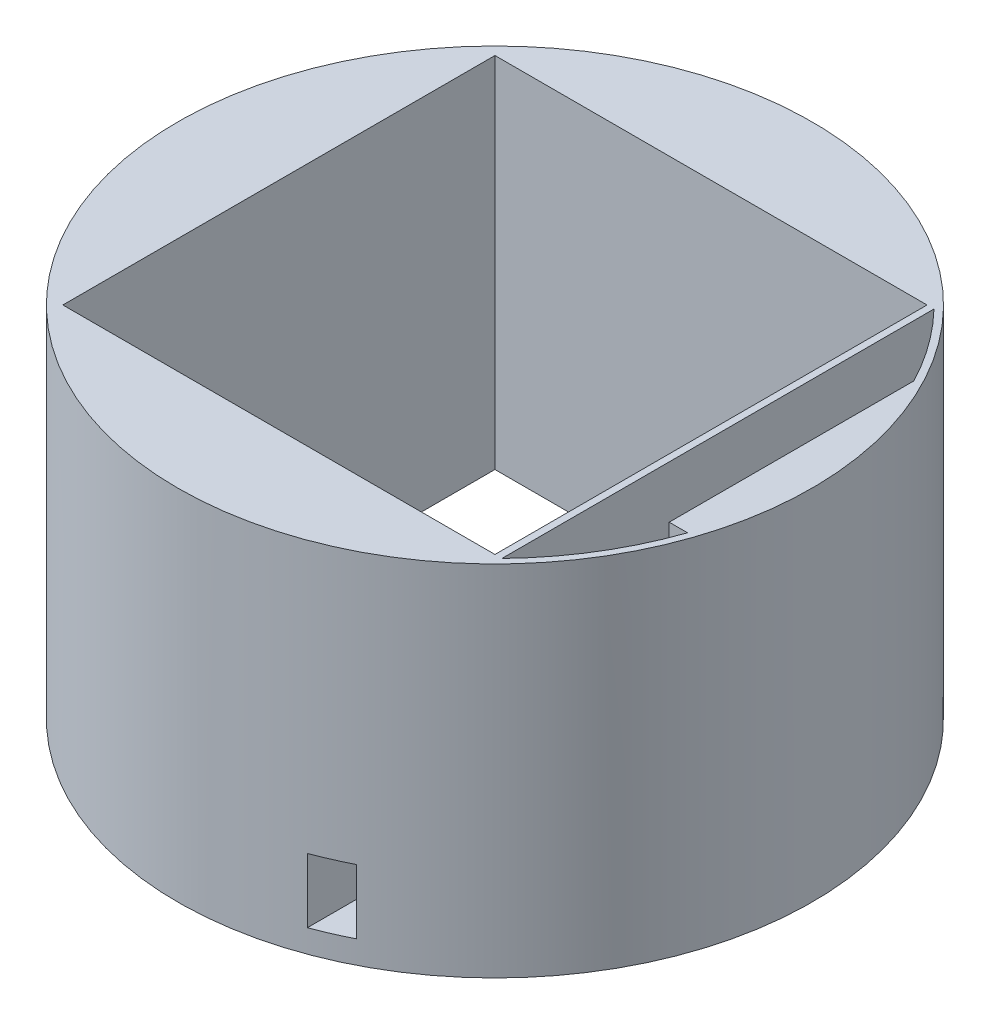
from build123d import *

# Parameters (mm, degrees)
BOSS_EXTRUDE1_DEPTH = 2.5
BOSS_EXTRUDE2_DEPTH = 4.5
SKETCH3_W           = 0.753987371
SKETCH3_H           = 12.516496397
BOSS_EXTRUDE3_DEPTH = 2.5
BOSS_EXTRUDE4_DEPTH = 29.5


with BuildPart() as part:
    # Sketch1 → Boss-Extrude1 (new body)
    with BuildSketch(Plane(origin=(0, 0, 0), x_dir=(1, 0, 0), z_dir=(0, 1, 0))):
        with BuildLine():
            Line((23.5, -23.5), (-23.5, -23.5))
            Line((-23.5, -23.5), (-25.258661881, -23.5))
            ThreePointArc((-25.258661881, -23.5), (12.625889377, -32.106649116), (34.5, 0))
            ThreePointArc((34.5, 0), (-5.56461177, 34.04827596), (-32.704933093, -10.983503603))
            Line((-32.704933093, -10.983503603), (-23.5, -10.983503603))
            Line((-23.5, -10.983503603), (-23.5, 23.5))
            Line((-23.5, 23.5), (23.5, 23.5))
            Line((23.5, 23.5), (23.5, -10.983503603))
            Line((23.5, -10.983503603), (31.93538088, -10.983503603))
            ThreePointArc((31.93538088, -10.983503603), (28.783275467, -17.66434139), (24.253987371, -23.5))
            Line((24.253987371, -23.5), (23.5, -23.5))
        make_face()
    extrude(amount=BOSS_EXTRUDE1_DEPTH)

    # Sketch2 → Boss-Extrude2 (add)
    with BuildSketch(Plane(origin=(0, 2.5, 0), x_dir=(1, 0, 0), z_dir=(0, 1, 0))):
        with BuildLine():
            Line((23.5, 23.5), (23.5, -10.983503603))
            Line((23.5, -10.983503603), (31.93538088, -10.983503603))
            ThreePointArc((31.93538088, -10.983503603), (28.783275467, -17.66434139), (24.253987371, -23.5))
            Line((24.253987371, -23.5), (15.688360219, -23.5))
            Line((15.688360219, -23.5), (15.688360219, -30.726622881))
            ThreePointArc((15.688360219, -30.726622881), (13.032214999, 31.943878478), (-32.704933093, -10.983503603))
            Line((-32.704933093, -10.983503603), (-23.5, -10.983503603))
            Line((-23.5, -10.983503603), (-23.5, 23.5))
            Line((-23.5, 23.5), (23.5, 23.5))
        make_face()
        with BuildLine():
            Line((11.957302625, -23.5), (-25.258661881, -23.5))
            ThreePointArc((-25.258661881, -23.5), (-7.991464927, -33.561681846), (11.957302625, -32.361596282))
            Line((11.957302625, -32.361596282), (11.957302625, -23.5))
        make_face()
    extrude(amount=BOSS_EXTRUDE2_DEPTH)

    # Sketch3 → Boss-Extrude3 (add)
    with BuildSketch(Plane(origin=(0, 7, 0), x_dir=(1, 0, 0), z_dir=(0, 1, 0))):
        with BuildLine():
            Line((-23.5, -23.5), (-23.5, -10.983503603))
            Line((-23.5, -10.983503603), (-32.704933093, -10.983503603))
            ThreePointArc((-32.704933093, -10.983503603), (-14.895360155, -31.118776419), (11.957302625, -32.361596282))
            Line((11.957302625, -32.361596282), (11.957302625, -23.5))
            Line((11.957302625, -23.5), (-23.5, -23.5))
        make_face()
        with Locations((23.876993686, -17.241751802)):
            Rectangle(SKETCH3_W, SKETCH3_H)
        with BuildLine():
            ThreePointArc((31.93538088, -10.983503603), (28.783275467, -17.66434139), (24.253987371, -23.5))
            Line((24.253987371, -23.5), (15.688360219, -23.5))
            Line((15.688360219, -23.5), (15.688360219, -30.726622881))
            ThreePointArc((15.688360219, -30.726622881), (13.032214999, 31.943878478), (-32.704933093, -10.983503603))
            Line((-32.704933093, -10.983503603), (-23.5, -10.983503603))
            Line((-23.5, -10.983503603), (-23.5, 23.5))
            Line((-23.5, 23.5), (23.5, 23.5))
            Line((23.5, 23.5), (23.5, -10.983503603))
            Line((23.5, -10.983503603), (31.93538088, -10.983503603))
        make_face()
    extrude(amount=BOSS_EXTRUDE3_DEPTH)

    # Sketch4 → Boss-Extrude4 (add)
    # profile 1 of 2: a face of its own
    with BuildSketch(Plane(origin=(0, 9.5, 0), x_dir=(1, 0, 0), z_dir=(0, 1, 0))):
        with BuildLine():
            Line((11.957302625, -23.5), (-23.5, -23.5))
            Line((-23.5, -23.5), (-23.5, 23.5))
            Line((-23.5, 23.5), (23.5, 23.5))
            Line((23.5, 23.5), (23.5, -23.5))
            Line((23.5, -23.5), (15.688360219, -23.5))
            Line((15.688360219, -23.5), (15.688360219, -30.726622881))
            ThreePointArc((15.688360219, -30.726622881), (29.423616599, -18.013905357), (34.5, 0))
            ThreePointArc((34.5, 0), (-28.308805525, 19.71957225), (11.957302625, -32.361596282))
            Line((11.957302625, -32.361596282), (11.957302625, -23.5))
        make_face()
        with BuildLine():
            ThreePointArc((31.93538088, -10.983503603), (28.783275467, -17.66434139), (24.253987371, -23.5))
            Line((24.253987371, -23.5), (24.253987371, -10.983503603))
            Line((24.253987371, -10.983503603), (24.253987371, 23.5))
            ThreePointArc((24.253987371, 23.5), (27.378747533, 19.771446252), (29.93538088, 15.632622139))
            Line((29.93538088, 15.632622139), (29.93538088, -10.983503603))
            Line((29.93538088, -10.983503603), (31.93538088, -10.983503603))
        make_face(mode=Mode.SUBTRACT)
    # profile 2 of 2: a face of its own
    with BuildSketch(Plane(origin=(0, 9.5, 0), x_dir=(1, 0, 0), z_dir=(0, 1, 0))):
        with BuildLine():
            Line((15.688360219, -23.5), (11.957302625, -23.5))
            Line((11.957302625, -23.5), (11.957302625, -32.361596282))
            ThreePointArc((11.957302625, -32.361596282), (13.846983535, -31.599225417), (15.688360219, -30.726622881))
            Line((15.688360219, -30.726622881), (15.688360219, -23.5))
        make_face()
    extrude(amount=BOSS_EXTRUDE4_DEPTH)


solid = part.part
